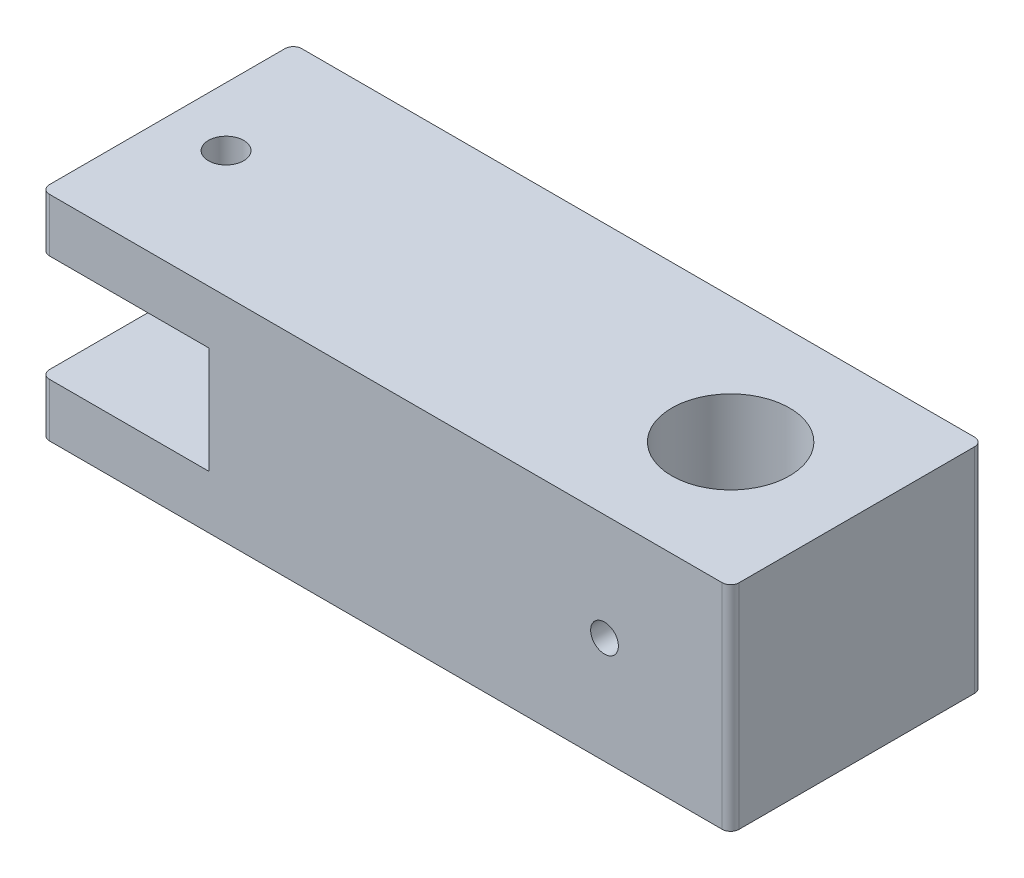
from build123d import *

# Parameters (mm, degrees)
SKETCH1_W                   = 82
SKETCH1_H                   = 30
SKETCH1_R                   = 7
SKETCH1_R_2                 = 2.1
BOSS_EXTRUDE1_DEPTH         = 25.4
SKETCH2_W                   = 20
SKETCH2_H                   = 12.7
CUT_EXTRUDE1_DEPTH          = 32
FILLET1_R                   = 1
TAP_DRILL_FOR_M4X0_7_TAP1_D = 3.3


with BuildPart() as part:
    # Sketch1 → Boss-Extrude1 (new body)
    with BuildSketch(Plane(origin=(0, 0, 0), x_dir=(1, 0, 0), z_dir=(0, 1, 0))):
        with Locations((-26, 0)):
            Rectangle(SKETCH1_W, SKETCH1_H)
        with Locations(Location((0, 0, 0), (0, 0, 270))):
            Circle(SKETCH1_R, mode=Mode.SUBTRACT)
        with Locations(Location((-60, 0, 0), (0, 0, 270))):
            Circle(SKETCH1_R_2, mode=Mode.SUBTRACT)
    extrude(amount=-BOSS_EXTRUDE1_DEPTH)

    # Sketch2 → Cut-Extrude1 (cut)
    with BuildSketch(Plane(origin=(0, 0, 15), x_dir=(-1, 0, 0), z_dir=(0, 0, -1))):
        with Locations((57, -12.7)):
            Rectangle(SKETCH2_W, SKETCH2_H)
    extrude(amount=CUT_EXTRUDE1_DEPTH, mode=Mode.SUBTRACT)

    # Fillet1
    fillet1_edges = [part.edges().sort_by_distance(p)[0] for p in [
        (-67, -3.175, -15),
        (-67, -3.175, 15),
        (15, -12.7, 15),
        (-67, -22.225, 15),
        (-67, -22.225, -15),
        (15, -12.7, -15),
    ]]
    fillet(fillet1_edges, radius=FILLET1_R)

    # Tap Drill for M4x0.7 Tap1 (through all)
    with Locations(Plane(origin=(0, -12.7, 15), x_dir=(1, 0, 0), z_dir=(0, 0, 1))):
        with Locations((0, 0)):
            Hole(TAP_DRILL_FOR_M4X0_7_TAP1_D / 2)


solid = part.part
